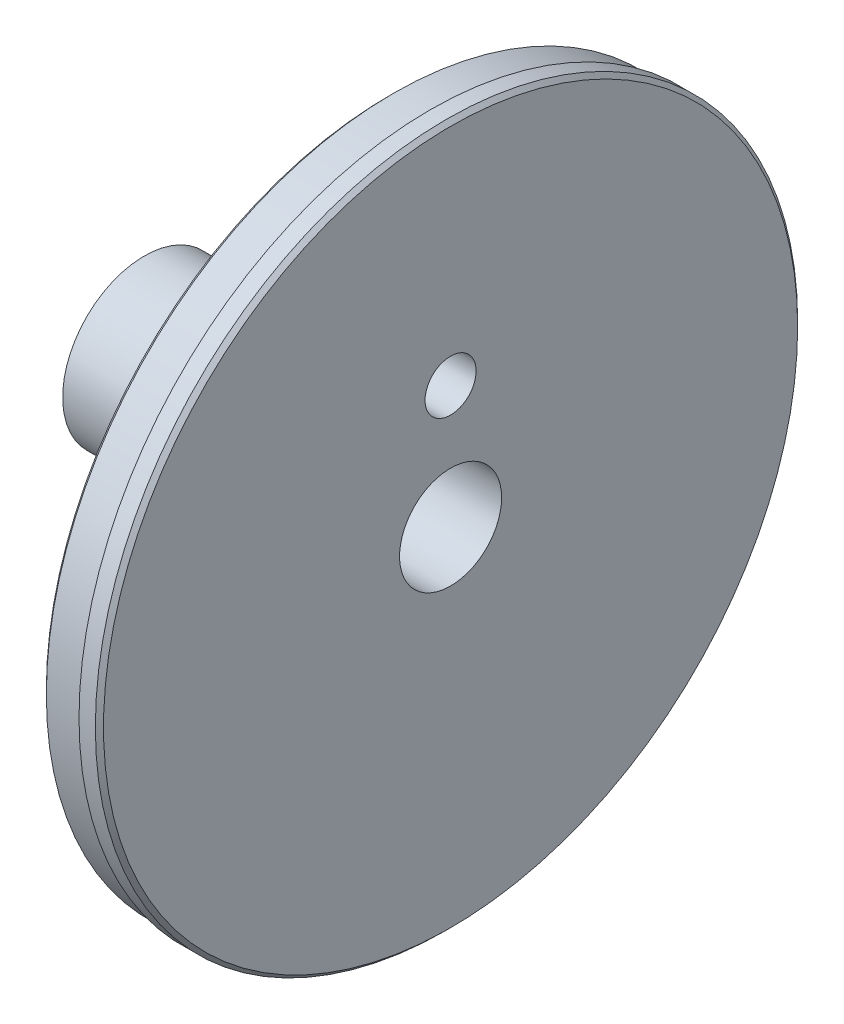
from build123d import *

# Parameters (mm, degrees)
SKETCH2_R          = 1.25
CUT_EXTRUDE1_DEPTH = 26.936075262
CHAMFER1_SIZE      = 0.2


with BuildPart() as part:
    # Sketch1 → Revolve1 (revolve)
    with BuildSketch(Plane.XY, mode=Mode.PRIVATE) as revolve1_sk:
        Polygon((0, 2.5), (0, 17.2), (-1, 17.2), (-1, 17), (-3, 17), (-3, 9), (-6, 9), (-6, 4), (-15, 4), (-15, 2.5), align=None)
    revolve(revolve1_sk.sketch.rotate(Axis((0, 0, 0), (-1, 0, 0)), 90), axis=Axis((0, 0, 0), (-1, 0, 0)))

    # Sketch2 → Cut-Extrude1 (cut, through all)
    with BuildSketch(Plane.ZY.offset(6)):
        with Locations((0, 6)):
            Circle(SKETCH2_R)
    extrude(amount=-CUT_EXTRUDE1_DEPTH, mode=Mode.SUBTRACT)

    # Chamfer1
    chamfer1_edges = [part.edges().sort_by_distance(p)[0] for p in [
        (-3, 0, 17),
        (0, 0, 17.2),
    ]]
    chamfer(chamfer1_edges, length=CHAMFER1_SIZE)


solid = part.part
